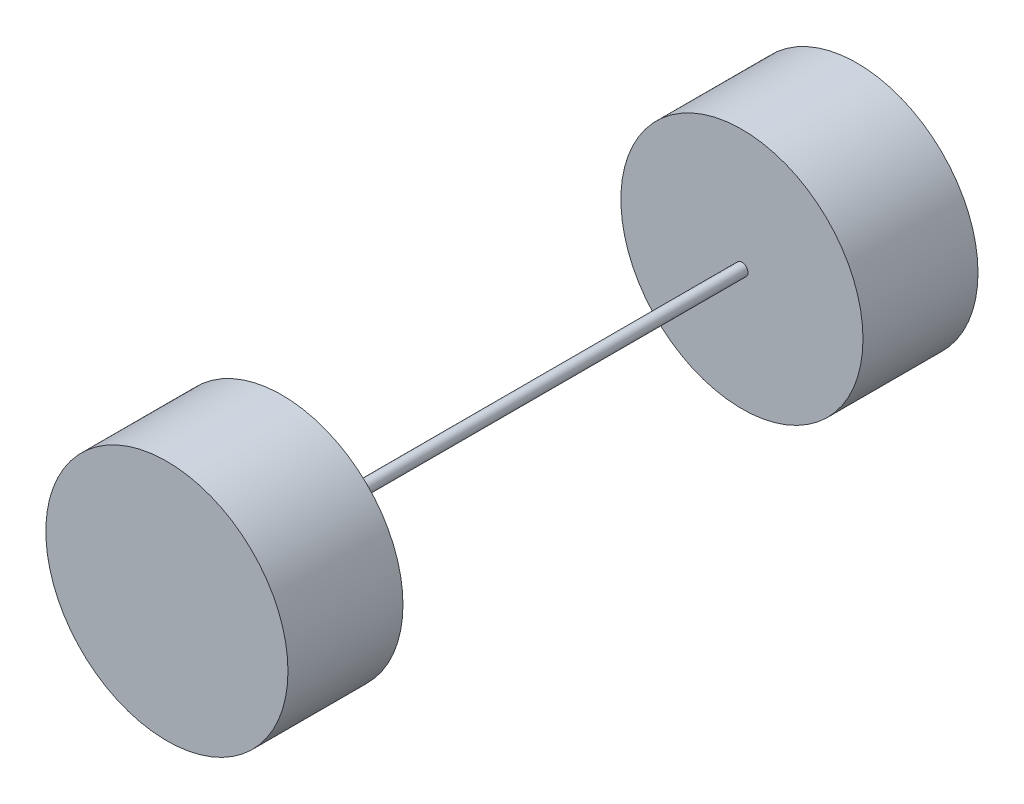
from build123d import *

# Parameters (mm, degrees)
SKETCH1_R           = 20
BOSS_EXTRUDE1_DEPTH = 19
SKETCH2_R           = 1
BOSS_EXTRUDE2_DEPTH = 76
SKETCH3_R           = 20
BOSS_EXTRUDE3_DEPTH = 19


with BuildPart() as part:
    # Sketch1 → Boss-Extrude1 (new body)
    with BuildSketch(Plane.XY):
        Circle(SKETCH1_R)
    extrude(amount=BOSS_EXTRUDE1_DEPTH)

    # Sketch2 → Boss-Extrude2 (add)
    with BuildSketch(Plane.XY.offset(19)):
        Circle(SKETCH2_R)
    extrude(amount=BOSS_EXTRUDE2_DEPTH)

    # Sketch3 → Boss-Extrude3 (add)
    with BuildSketch(Plane.XY.offset(95)):
        Circle(SKETCH3_R)
    extrude(amount=BOSS_EXTRUDE3_DEPTH)


solid = part.part
